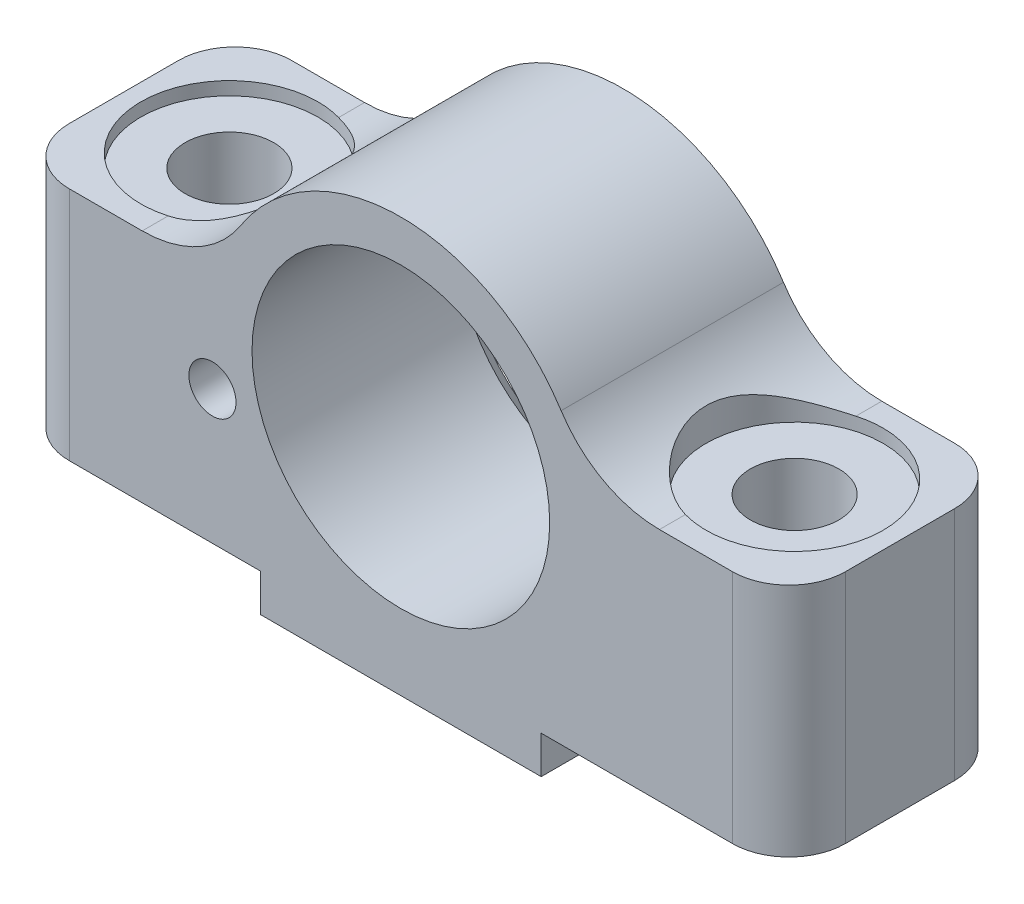
from build123d import *

# Parameters (mm, degrees)
SKETCH_3_R                       = 7.9
EXTRUDE_1_DEPTH                  = 11.8
FILLET_1_R                       = 6.2
FILLET_2_R                       = 3
CHAMFER_1_SIZE                   = 1
HOLE_WIZARD_4_7_4_7_2_D          = 4.7
SKETCH_18_W                      = 4.7
SKETCH_18_H                      = 8.206022117
HOLE_WIZARD_9_4_9_4_1_AT_2_COUNT = 2
HOLE_WIZARD_9_4_9_4_1_AT_2_PITCH = 30
HOLE_WIZARD_M3_2_D               = 2.5
HOLE_WIZARD_M3_2_DEPTH           = 3
HOLE_WIZARD_M3_2_TIP             = 0.751075774


with BuildPart() as part:
    # 스케치3 → 보스-돌출1 (new body)
    with BuildSketch(Plane.XY):
        with BuildLine():
            Line((-7.45, 0), (7.45, 0))
            Line((7.45, 0), (7.45, 2))
            Line((7.45, 2), (20.6, 2))
            Line((20.6, 2), (20.6, 14.5))
            Line((20.6, 14.5), (9.765842668, 14.5))
            ThreePointArc((9.765842668, 14.5), (0, 22.006022117), (-9.765842668, 14.5))
            Line((-9.765842668, 14.5), (-20.6, 14.5))
            Line((-20.6, 14.5), (-20.6, 2))
            Line((-20.6, 2), (-7.45, 2))
            Line((-7.45, 2), (-7.45, 0))
        make_face()
        with Locations((0, 11.9)):
            Circle(SKETCH_3_R, mode=Mode.SUBTRACT)
    extrude(amount=EXTRUDE_1_DEPTH)

    # 필렛1
    fillet_1_edges = [part.edges().sort_by_distance(p)[0] for p in [
        (-9.765842668, 14.5, 5.9),
        (9.765842668, 14.5, 5.9),
    ]]
    fillet(fillet_1_edges, radius=FILLET_1_R)

    # 필렛2
    fillet_2_edges = [part.edges().sort_by_distance(p)[0] for p in [
        (20.6, 8.25, 0),
        (20.6, 8.25, 11.8),
        (-20.6, 8.25, 11.8),
        (-20.6, 8.25, 0),
    ]]
    fillet(fillet_2_edges, radius=FILLET_2_R)

    # 모따기1
    chamfer_1_edges = [part.edges().sort_by_distance(p)[0] for p in [
        (-7.9, 11.9, 0),
    ]]
    chamfer(chamfer_1_edges, length=CHAMFER_1_SIZE)

    # Ø4.7 (4.7) 지름 구멍2 (through all)
    with Locations(Plane.XZ):
        with Locations((15, 5.9), (-15, 5.9)):
            Hole(HOLE_WIZARD_4_7_4_7_2_D / 2)

    # 스케치18 → Ø9.4 (9.4) 지름 구멍1 (revolve, cut)
    with BuildSketch(Plane(origin=(-15, 13.8, 5.9), x_dir=(0, 0, -1), z_dir=(1, 0, 0))):
        with Locations((2.35, 4.103011058)):
            Rectangle(SKETCH_18_W, SKETCH_18_H)
    hole_wizard_9_4_9_4_1 = revolve(axis=Axis((-15, 7.45, 5.9), (0, 1, 0)), mode=Mode.SUBTRACT)

    # Ø9.4 (9.4) 지름 구멍1 at 2: Ø9.4 (9.4) 지름 구멍1 ×2
    with Locations(*[(i * HOLE_WIZARD_9_4_9_4_1_AT_2_PITCH, 0, 0) for i in range(1, HOLE_WIZARD_9_4_9_4_1_AT_2_COUNT)]):
        add(hole_wizard_9_4_9_4_1, mode=Mode.SUBTRACT)

    # M3 나사 구멍2
    with Locations(Plane.XY.offset(11.8)):
        with Locations((-10, 9.1)):
            Hole(HOLE_WIZARD_M3_2_D / 2, depth=HOLE_WIZARD_M3_2_DEPTH)
            with Locations((0, 0, -(HOLE_WIZARD_M3_2_DEPTH + HOLE_WIZARD_M3_2_TIP / 2))):  # 118° drill point
                Cone(0, HOLE_WIZARD_M3_2_D / 2, HOLE_WIZARD_M3_2_TIP, mode=Mode.SUBTRACT)


solid = part.part
